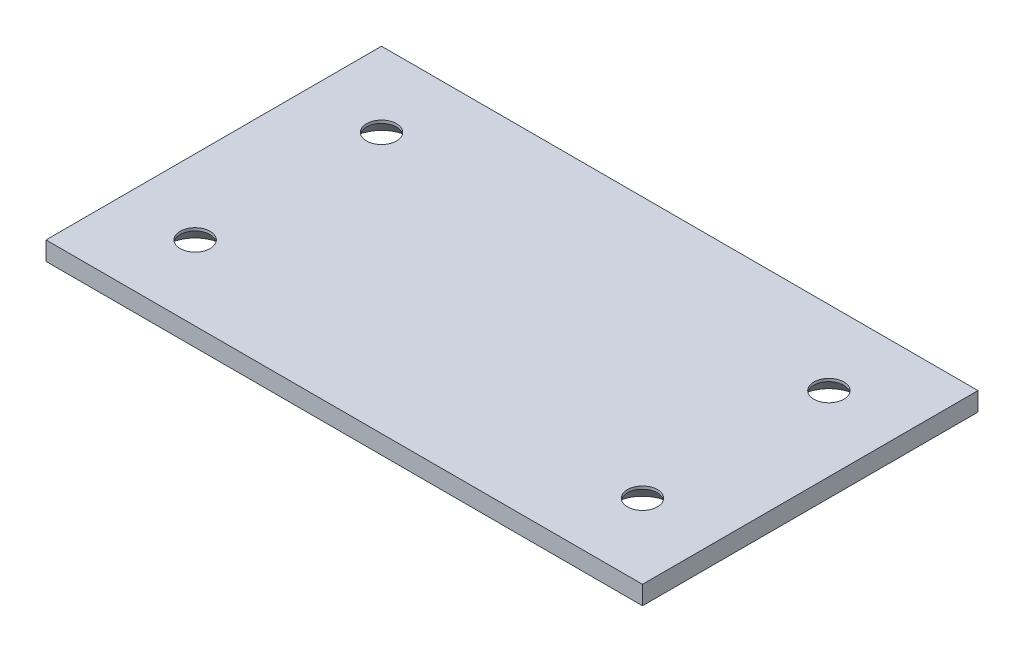
from build123d import *

# Parameters (mm, degrees)
SKETCH1_W                                    = 101.6
SKETCH1_H                                    = 57.15
BOSS_EXTRUDE1_DEPTH                          = 3.175
CSK_FOR_10_FLAT_HEAD_MACHINE_SCREW1_AT_COUNT = 2
CSK_FOR_10_FLAT_HEAD_MACHINE_SCREW1_AT_PITCH = 31.75
CSK_FOR_10_FLAT_HEAD_MACHINE_SCREW1_2_COUNT  = 2
CSK_FOR_10_FLAT_HEAD_MACHINE_SCREW1_2_PITCH  = 76.2
CSK_FOR_10_FLAT_HEAD_MACHINE_SCREW1_3_COUNT  = 2
CSK_FOR_10_FLAT_HEAD_MACHINE_SCREW1_3_PITCH  = 82.55


with BuildPart() as part:
    # Sketch1 → Boss-Extrude1 (new body)
    with BuildSketch(Plane(origin=(0, 0, 0), x_dir=(1, 0, 0), z_dir=(0, 1, 0))):
        Rectangle(SKETCH1_W, SKETCH1_H)
    extrude(amount=BOSS_EXTRUDE1_DEPTH)

    # Sketch10 → CSK for #10 Flat Head Machine Screw1 (revolve, cut)
    with BuildSketch(Plane(origin=(-38.1, 0, 15.875), x_dir=(0, 0, -1), z_dir=(1, 0, 0))):
        Polygon((0, 0), (0, 3.175), (2.5527, 3.175), (2.5527, 2.688180894), (4.8895, 0), align=None)
    csk_for_10_flat_head_machine_screw1 = revolve(axis=Axis((-38.1, -6.35, 15.875), (0, 1, 0)), mode=Mode.SUBTRACT)

    # CSK for #10 Flat Head Machine Screw1 at: CSK for #10 Flat Head Machine Screw1 ×2
    with Locations(*[(0, 0, -i * CSK_FOR_10_FLAT_HEAD_MACHINE_SCREW1_AT_PITCH) for i in range(1, CSK_FOR_10_FLAT_HEAD_MACHINE_SCREW1_AT_COUNT)]):
        add(csk_for_10_flat_head_machine_screw1, mode=Mode.SUBTRACT)

    # CSK for _10 Flat Head Machine Screw1 2: CSK for #10 Flat Head Machine Screw1 ×2
    with Locations(*[(i * CSK_FOR_10_FLAT_HEAD_MACHINE_SCREW1_2_PITCH, 0, 0) for i in range(1, CSK_FOR_10_FLAT_HEAD_MACHINE_SCREW1_2_COUNT)]):
        add(csk_for_10_flat_head_machine_screw1, mode=Mode.SUBTRACT)

    # CSK for _10 Flat Head Machine Screw1 3: CSK for #10 Flat Head Machine Screw1 ×2
    with Locations(*[Vector(0.9230769230769231, 0, -0.38461538461538464) * (i * CSK_FOR_10_FLAT_HEAD_MACHINE_SCREW1_3_PITCH) for i in range(1, CSK_FOR_10_FLAT_HEAD_MACHINE_SCREW1_3_COUNT)]):
        add(csk_for_10_flat_head_machine_screw1, mode=Mode.SUBTRACT)


solid = part.part
